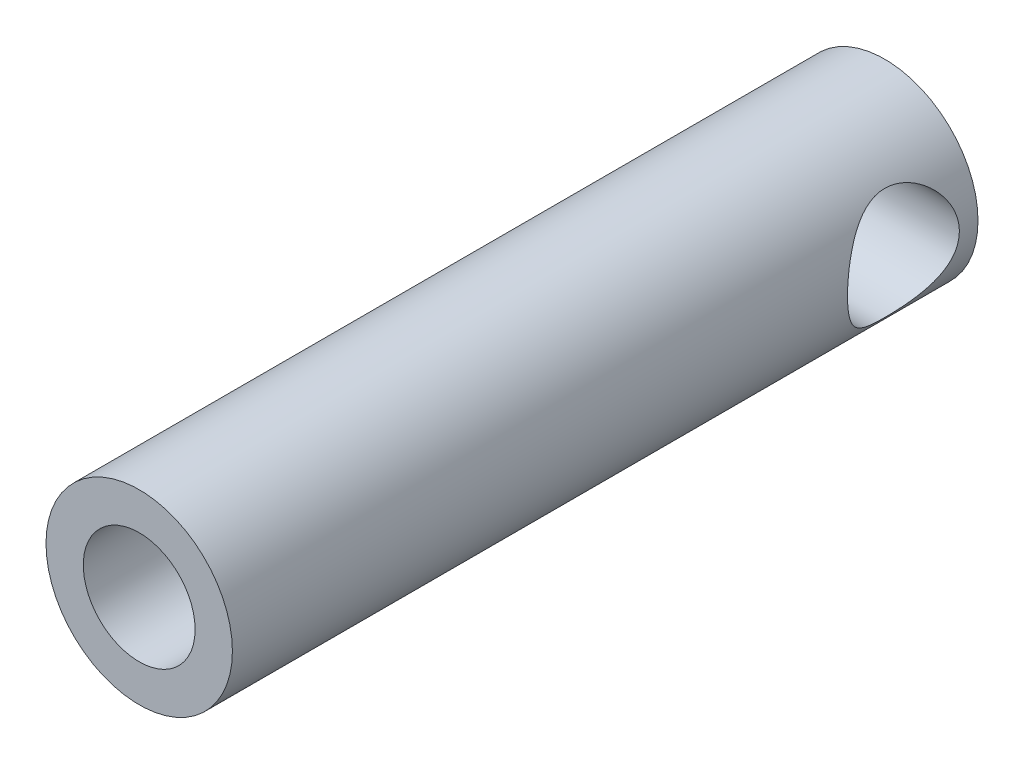
from build123d import *

# Parameters (mm, degrees)
SKETCH1_R               = 3.175
BOSS_EXTRUDE1_DEPTH     = 25.4
SKETCH2_R               = 1.905
CUT_EXTRUDE1_DEPTH      = 12.7
CUT_EXTRUDE2_DEPTH      = 26.793821935
CUT_EXTRUDE2_DEPTH_BACK = 26.793821935
SKETCH3_R               = 1.905


with BuildPart() as part:
    # Sketch1 → Boss-Extrude1 (new body)
    with BuildSketch(Plane.XY):
        Circle(SKETCH1_R)
    extrude(amount=BOSS_EXTRUDE1_DEPTH)

    # Sketch2 → Cut-Extrude1 (cut)
    with BuildSketch(Plane.XY.offset(25.4)):
        Circle(SKETCH2_R)
    extrude(amount=-CUT_EXTRUDE1_DEPTH, mode=Mode.SUBTRACT)

    # Sketch3 → Cut-Extrude2 (cut, two sides: drawn at the far end of the back side and taken through both)
    with BuildSketch(Plane(origin=(0, 0, 0), x_dir=(0, 0, -1), z_dir=(1, 0, 0)).offset(-CUT_EXTRUDE2_DEPTH_BACK)):
        with Locations((-2.54, 0)):
            Circle(SKETCH3_R)
    extrude(amount=CUT_EXTRUDE2_DEPTH + CUT_EXTRUDE2_DEPTH_BACK, mode=Mode.SUBTRACT)


solid = part.part
